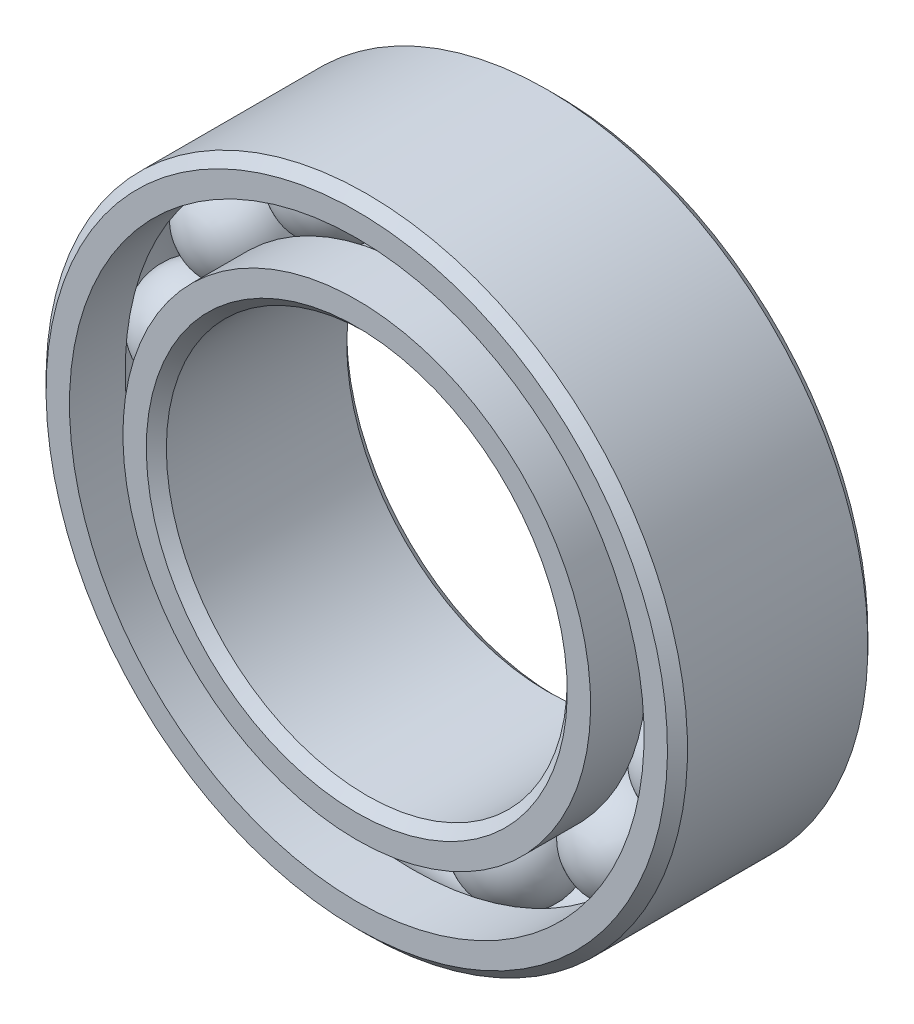
from build123d import *

# Parameters (mm, degrees)
CIRPATTERN1_COUNT = 13


with BuildPart() as part:
    # Sketch6 → Revolve5 (revolve)
    with BuildSketch(Plane(origin=(0, 0, 0), x_dir=(0, 0, -1), z_dir=(1, 0, 0)), mode=Mode.PRIVATE) as revolve5_sk:
        with BuildLine():
            Line((4.5, 16), (5, 15.5))
            Line((5, 15.5), (5, 14.333333333))
            Line((5, 14.333333333), (2.222222222, 14.333333333))
            ThreePointArc((2.222222222, 14.333333333), (0, 15.591534175), (-2.222222222, 14.333333333))
            Line((-2.222222222, 14.333333333), (-5, 14.333333333))
            Line((-5, 14.333333333), (-5, 15.5))
            Line((-5, 15.5), (-4.5, 16))
            Line((-4.5, 16), (4.5, 16))
        make_face()
    revolve(revolve5_sk.sketch.rotate(Axis((0, 0, 5), (0, 0, -1)), 180), axis=Axis((0, 0, 5), (0, 0, -1)))


with BuildPart() as body_2:
    # Sketch3 → Revolve3 (revolve)
    with BuildSketch(Plane(origin=(0, 0, 0), x_dir=(0, 0, -1), z_dir=(1, 0, 0)), mode=Mode.PRIVATE) as revolve3_sk:
        with BuildLine():
            Line((-5, 11.666666667), (-2.222222222, 11.666666667))
            ThreePointArc((-2.222222222, 11.666666667), (0, 10.408465825), (2.222222222, 11.666666667))
            Line((2.222222222, 11.666666667), (5, 11.666666667))
            Line((5, 11.666666667), (5, 10.5))
            Line((5, 10.5), (4.5, 10))
            Line((4.5, 10), (-4.5, 10))
            Line((-4.5, 10), (-5, 10.5))
            Line((-5, 10.5), (-5, 11.666666667))
        make_face()
    revolve(revolve3_sk.sketch.rotate(Axis((0, 0, 5), (0, 0, -1)), 180), axis=Axis((0, 0, 5), (0, 0, -1)))


with BuildPart() as body_3:
    # Sketch4 → Revolve4 (revolve)
    with BuildSketch(Plane(origin=(0, 0, 0), x_dir=(0, 0, -1), z_dir=(1, 0, 0))):
        with BuildLine():
            Line((-2.591534175, 13), (2.591534175, 13))
            ThreePointArc((2.591534175, 13), (0, 15.591534175), (-2.591534175, 13))
        make_face()
    revolve(axis=Axis((0, 13, 2.591534175), (0, 0, -1)))


with BuildPart() as cirpattern1_1:
    # CirPattern1: pattern copy
    add(body_3.part.rotate(Axis((0, 0, 0), (0, 0, 1)), 1 * 360 / CIRPATTERN1_COUNT))


with BuildPart() as cirpattern1_2:
    # CirPattern1: pattern copy
    add(body_3.part.rotate(Axis((0, 0, 0), (0, 0, 1)), 2 * 360 / CIRPATTERN1_COUNT))


with BuildPart() as cirpattern1_3:
    # CirPattern1: pattern copy
    add(body_3.part.rotate(Axis((0, 0, 0), (0, 0, 1)), 3 * 360 / CIRPATTERN1_COUNT))


with BuildPart() as cirpattern1_4:
    # CirPattern1: pattern copy
    add(body_3.part.rotate(Axis((0, 0, 0), (0, 0, 1)), 4 * 360 / CIRPATTERN1_COUNT))


with BuildPart() as cirpattern1_5:
    # CirPattern1: pattern copy
    add(body_3.part.rotate(Axis((0, 0, 0), (0, 0, 1)), 5 * 360 / CIRPATTERN1_COUNT))


with BuildPart() as cirpattern1_6:
    # CirPattern1: pattern copy
    add(body_3.part.rotate(Axis((0, 0, 0), (0, 0, 1)), 6 * 360 / CIRPATTERN1_COUNT))


with BuildPart() as cirpattern1_7:
    # CirPattern1: pattern copy
    add(body_3.part.rotate(Axis((0, 0, 0), (0, 0, 1)), 7 * 360 / CIRPATTERN1_COUNT))


with BuildPart() as cirpattern1_8:
    # CirPattern1: pattern copy
    add(body_3.part.rotate(Axis((0, 0, 0), (0, 0, 1)), 8 * 360 / CIRPATTERN1_COUNT))


with BuildPart() as cirpattern1_9:
    # CirPattern1: pattern copy
    add(body_3.part.rotate(Axis((0, 0, 0), (0, 0, 1)), 9 * 360 / CIRPATTERN1_COUNT))


with BuildPart() as cirpattern1_10:
    # CirPattern1: pattern copy
    add(body_3.part.rotate(Axis((0, 0, 0), (0, 0, 1)), 10 * 360 / CIRPATTERN1_COUNT))


with BuildPart() as cirpattern1_11:
    # CirPattern1: pattern copy
    add(body_3.part.rotate(Axis((0, 0, 0), (0, 0, 1)), 11 * 360 / CIRPATTERN1_COUNT))


with BuildPart() as cirpattern1_12:
    # CirPattern1: pattern copy
    add(body_3.part.rotate(Axis((0, 0, 0), (0, 0, 1)), 12 * 360 / CIRPATTERN1_COUNT))


solid = Compound([part.part, body_2.part, body_3.part, cirpattern1_1.part, cirpattern1_2.part, cirpattern1_3.part, cirpattern1_4.part, cirpattern1_5.part, cirpattern1_6.part, cirpattern1_7.part, cirpattern1_8.part, cirpattern1_9.part, cirpattern1_10.part, cirpattern1_11.part, cirpattern1_12.part])
